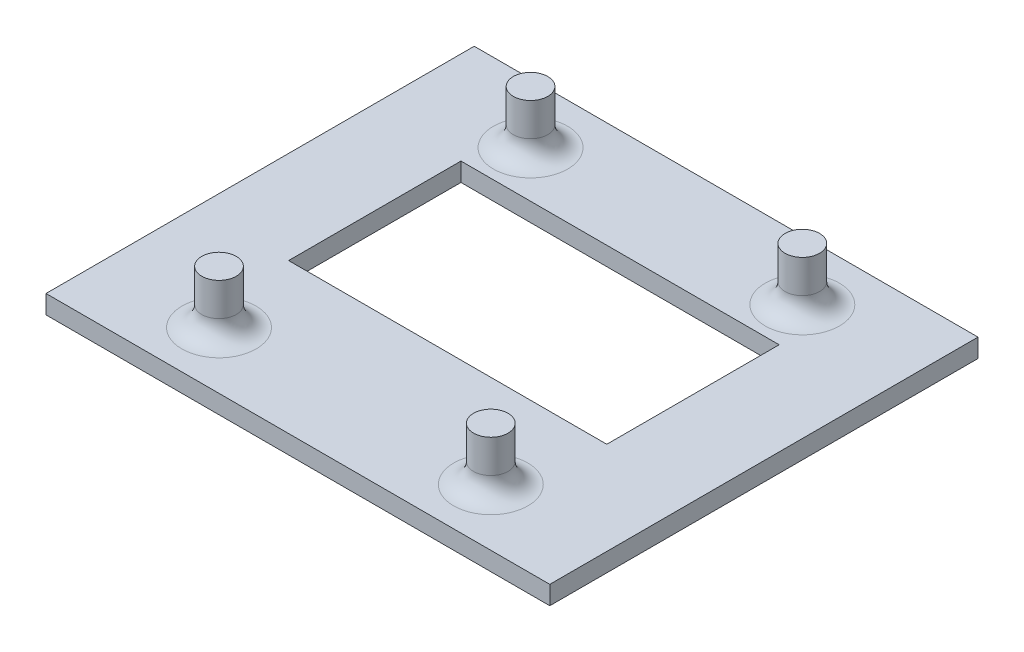
from build123d import *

# Parameters (mm, degrees)
SKETCH1_W           = 38
SKETCH1_H           = 32.3
SKETCH1_W_2         = 24
SKETCH1_H_2         = 13
BOSS_EXTRUDE1_DEPTH = 1.4
SKETCH2_R           = 1.3
BOSS_EXTRUDE2_DEPTH = 4
FILLET1_R           = 1.5


with BuildPart() as part:
    # Sketch1 → Boss-Extrude1 (new body)
    with BuildSketch(Plane(origin=(0, 0, 0), x_dir=(1, 0, 0), z_dir=(0, 1, 0))):
        with Locations((0, -1.65)):
            Rectangle(SKETCH1_W, SKETCH1_H)
        Rectangle(SKETCH1_W_2, SKETCH1_H_2, mode=Mode.SUBTRACT)
    extrude(amount=BOSS_EXTRUDE1_DEPTH)

    # Sketch2 → Boss-Extrude2 (add)
    with BuildSketch(Plane(origin=(0, 1.4, 0), x_dir=(1, 0, 0), z_dir=(0, 1, 0))):
        with Locations(Location((-10.25, 10, 0), (0, 0, 270))):
            Circle(SKETCH2_R)
        with Locations(Location((-10.25, -13.5, 0), (0, 0, 270))):
            Circle(SKETCH2_R)
        with Locations(Location((10.25, -13.5, 0), (0, 0, 90))):
            Circle(SKETCH2_R)
        with Locations(Location((10.25, 10, 0), (0, 0, 90))):
            Circle(SKETCH2_R)
    extrude(amount=BOSS_EXTRUDE2_DEPTH)

    # Fillet1
    fillet1_edges = [part.edges().sort_by_distance(p)[0] for p in [
        (-10.25, 1.4, -11.3),
        (-10.25, 1.4, 12.2),
        (10.25, 1.4, 14.8),
        (10.25, 1.4, -8.7),
    ]]
    fillet(fillet1_edges, radius=FILLET1_R)


solid = part.part
